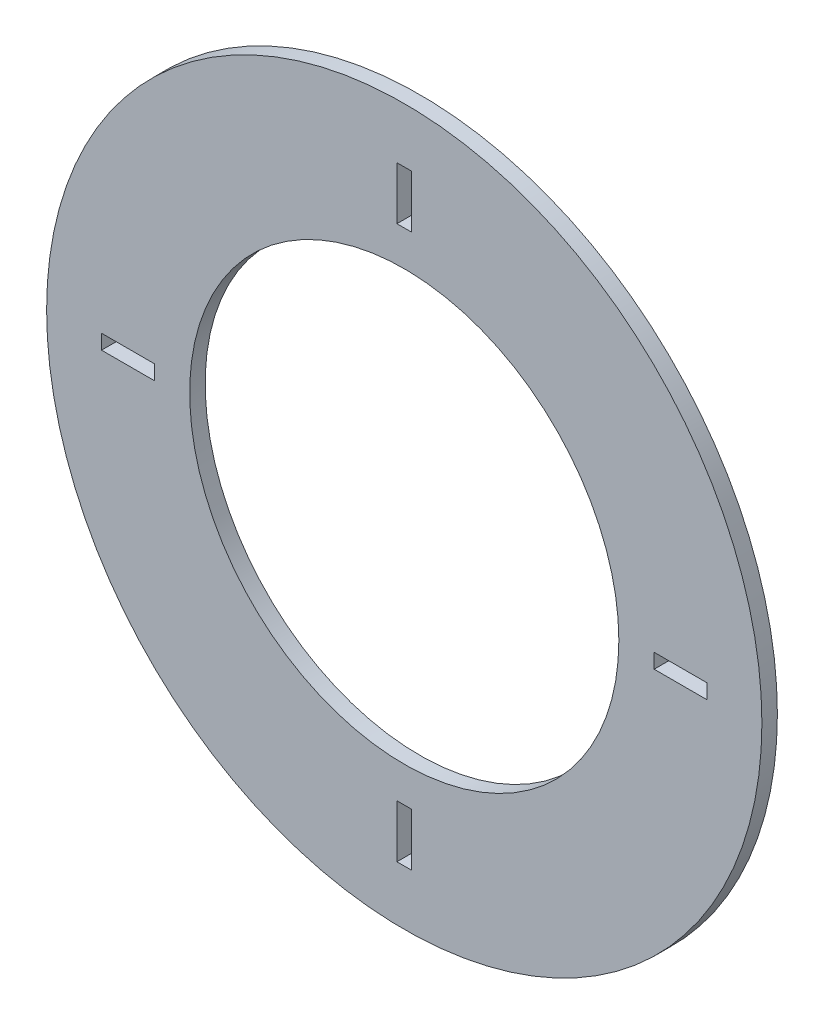
from build123d import *

# Parameters (mm, degrees)
SKETCH1_R           = 63.5
SKETCH1_R_2         = 38.1
BOSS_EXTRUDE1_DEPTH = 2.750000088
SKETCH2_W           = 9.380000036
SKETCH2_H           = 2.605000124
SKETCH2_W_2         = 2.605000124
SKETCH2_H_2         = 9.380000036
CUT_EXTRUDE1_DEPTH  = 90.844657607


with BuildPart() as part:
    # Sketch1 → Boss-Extrude1 (new body)
    with BuildSketch(Plane(origin=(0, 0, 0), x_dir=(0, 1, 0), z_dir=(0, 0, 1))):
        with Locations(Location((0, 0, 0), (0, 0, 270))):
            Circle(SKETCH1_R)
        with Locations(Location((0, 0, 0), (0, 0, 270))):
            Circle(SKETCH1_R_2, mode=Mode.SUBTRACT)
    extrude(amount=BOSS_EXTRUDE1_DEPTH)

    # Sketch2 → Cut-Extrude1 (cut, through all)
    with BuildSketch(Plane.XY.offset(2.750000088)):
        with Locations((49.055203892, 0)):
            Rectangle(SKETCH2_W, SKETCH2_H)
        with Locations((0, 49.055203892)):
            Rectangle(SKETCH2_W_2, SKETCH2_H_2)
        with Locations((0, -49.055203892)):
            Rectangle(SKETCH2_W_2, SKETCH2_H_2)
        with Locations((-49.055203892, 0)):
            Rectangle(SKETCH2_W, SKETCH2_H)
    extrude(amount=-CUT_EXTRUDE1_DEPTH, mode=Mode.SUBTRACT)


solid = part.part
